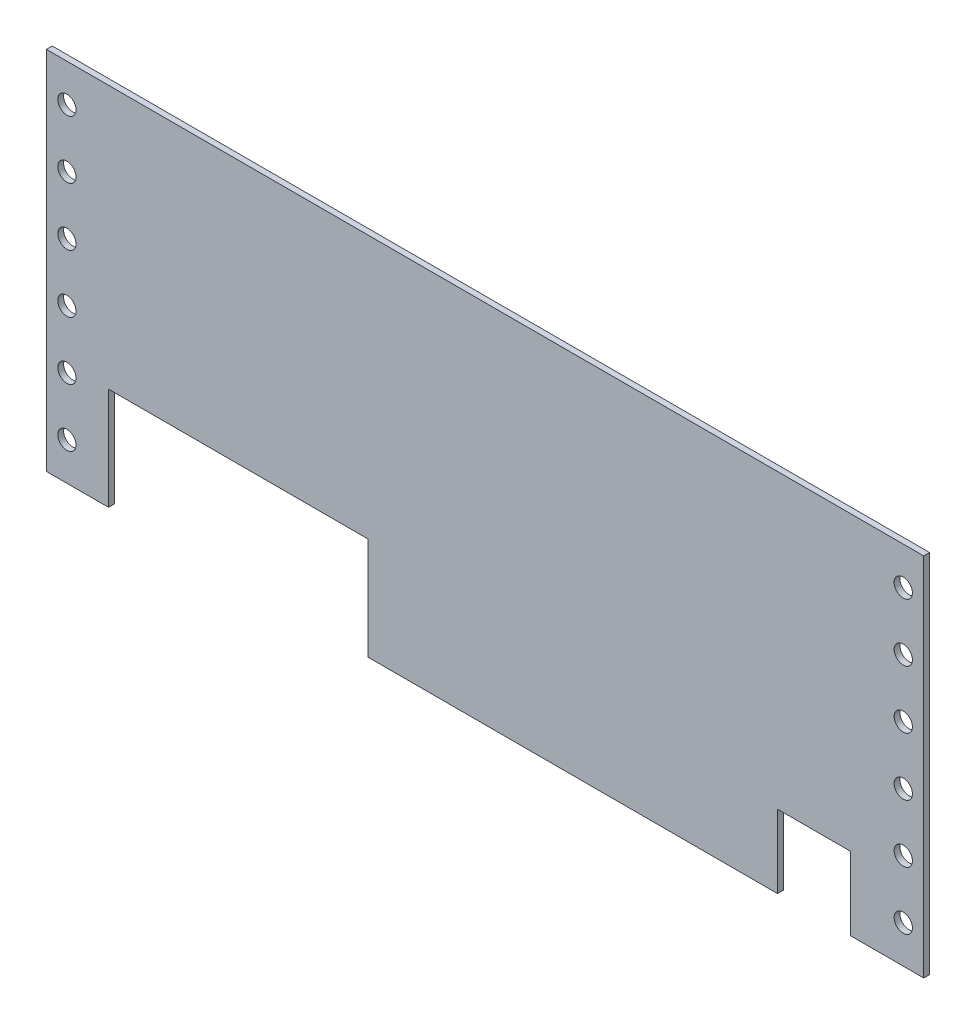
from build123d import *

# Parameters (mm, degrees)
SKETCH1_W           = 240
SKETCH1_H           = 100
BOSS_EXTRUDE1_DEPTH = 1.6
CUT_EXTRUDE1_REACH  = 262.005
SKETCH2_R           = 2.5
LPATTERN1_COUNT     = 6
LPATTERN1_PITCH     = 15.88
CUT_EXTRUDE2_REACH  = 262.005
SKETCH3_W           = 71
SKETCH3_H           = 28
CUT_EXTRUDE3_REACH  = 262.005
SKETCH4_W           = 20
SKETCH4_H           = 20


with BuildPart() as part:
    # Sketch1 → Boss-Extrude1 (new body)
    with BuildSketch(Plane.XY):
        with Locations((120, 50)):
            Rectangle(SKETCH1_W, SKETCH1_H)
    extrude(amount=BOSS_EXTRUDE1_DEPTH)

    # Sketch2 → Cut-Extrude1 (cut, up to next)
    with BuildSketch(Plane.XY.offset(1.6), mode=Mode.PRIVATE) as cut_extrude1_sk1:
        with Locations((5.6, 10.3)):
            Circle(SKETCH2_R)
    cut_extrude1_tool1 = extrude(cut_extrude1_sk1.sketch, amount=-CUT_EXTRUDE1_REACH, mode=Mode.PRIVATE) & part.part
    # Sketch2 → Cut-Extrude1 (cut, up to next)
    with BuildSketch(Plane.XY.offset(1.6), mode=Mode.PRIVATE) as cut_extrude1_sk2:
        with Locations((234.4, 10.3)):
            Circle(SKETCH2_R)
    cut_extrude1_tool2 = extrude(cut_extrude1_sk2.sketch, amount=-CUT_EXTRUDE1_REACH, mode=Mode.PRIVATE) & part.part
    cut_extrude1_1 = cut_extrude1_tool1.solids().sort_by_distance((5.6, 10.3, 1.6))[0]
    add(cut_extrude1_1, mode=Mode.SUBTRACT)
    cut_extrude1_2 = cut_extrude1_tool2.solids().sort_by_distance((234.4, 10.3, 1.6))[0]
    add(cut_extrude1_2, mode=Mode.SUBTRACT)
    cut_extrude1 = cut_extrude1_1 + cut_extrude1_2  # Cut-Extrude1 as one shape, for the pattern or mirror that repeats it

    # LPattern1: Cut-Extrude1 ×6
    with Locations(*[(0, i * LPATTERN1_PITCH, 0) for i in range(1, LPATTERN1_COUNT)]):
        add(cut_extrude1, mode=Mode.SUBTRACT)

    # Sketch3 → Cut-Extrude2 (cut, up to next)
    with BuildSketch(Plane.XY.offset(1.6), mode=Mode.PRIVATE) as cut_extrude2_sk1:
        with Locations((52.5, 14)):
            Rectangle(SKETCH3_W, SKETCH3_H)
    cut_extrude2_tool1 = extrude(cut_extrude2_sk1.sketch, amount=-CUT_EXTRUDE2_REACH, mode=Mode.PRIVATE) & part.part
    add(cut_extrude2_tool1.solids().sort_by_distance((52.5, 14, 1.6))[0], mode=Mode.SUBTRACT)

    # Sketch4 → Cut-Extrude3 (cut, up to next)
    with BuildSketch(Plane(origin=(0, 0, 0), x_dir=(-1, 0, 0), z_dir=(0, 0, -1)), mode=Mode.PRIVATE) as cut_extrude3_sk1:
        with Locations((-210, 10)):
            Rectangle(SKETCH4_W, SKETCH4_H)
    cut_extrude3_tool1 = extrude(cut_extrude3_sk1.sketch, amount=-CUT_EXTRUDE3_REACH, mode=Mode.PRIVATE) & part.part
    add(cut_extrude3_tool1.solids().sort_by_distance((210, 10, 0))[0], mode=Mode.SUBTRACT)


solid = part.part
